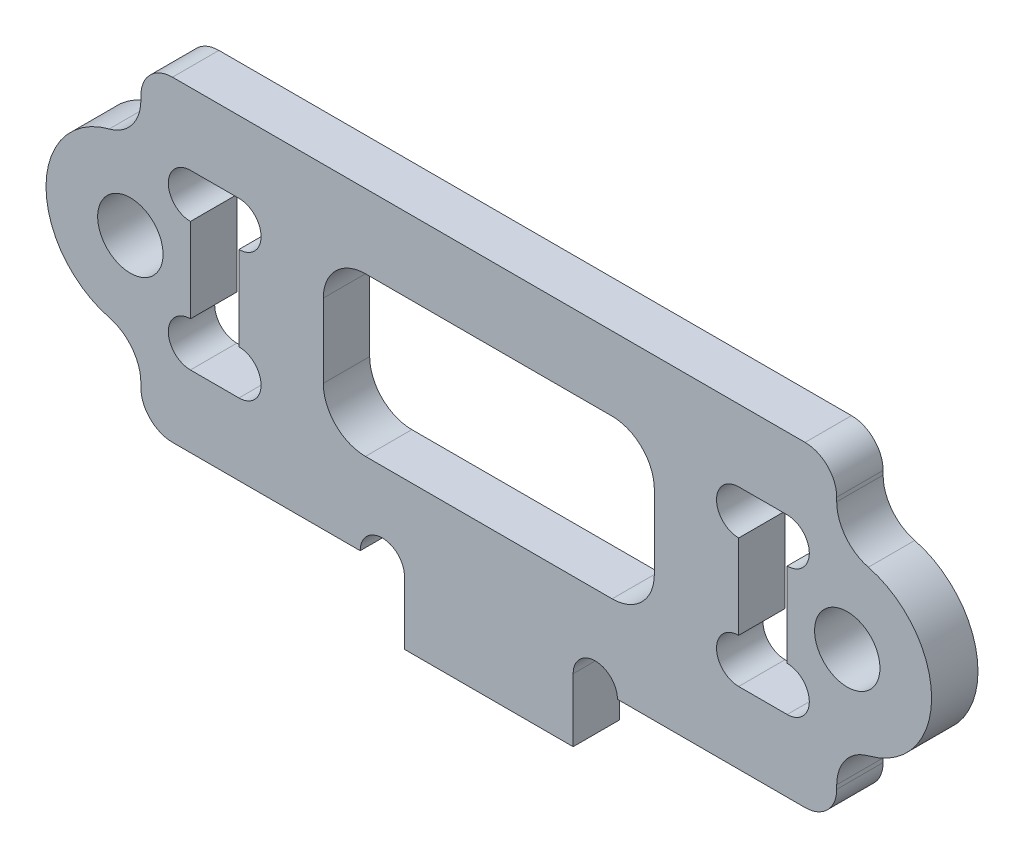
from build123d import *

# Parameters (mm, degrees)
SKETCH_1_R      = 1.55
SKETCH_1_W      = 15.7
SKETCH_1_H      = 7.5
EXTRUDE_1_DEPTH = 2.2
FILLET_1_R      = 2
FILLET_2_R      = 1.5
FILLET_3_R      = 2


with BuildPart() as part:
    # 草图1 → 凸台-拉伸1 (new body)
    with BuildSketch(Plane.XY):
        with BuildLine():
            ThreePointArc((-16.5, 3.968626967), (-21, 0), (-16.5, -3.968626967))
            Line((-16.5, -3.968626967), (-16.5, -7.5))
            Line((-16.5, -7.5), (-6.1, -7.5))
            ThreePointArc((-6.1, -7.5), (-5.05, -6.45), (-4, -7.5))
            Line((-4, -7.5), (-4, -10.5))
            Line((-4, -10.5), (4, -10.5))
            Line((4, -10.5), (4, -7.5))
            ThreePointArc((4, -7.5), (5.05, -6.45), (6.1, -7.5))
            Line((6.1, -7.5), (16.5, -7.5))
            Line((16.5, -7.5), (16.5, -3.968626967))
            ThreePointArc((16.5, -3.968626967), (21, 0), (16.5, 3.968626967))
            Line((16.5, 3.968626967), (16.5, 7.5))
            Line((16.5, 7.5), (-16.5, 7.5))
            Line((-16.5, 7.5), (-16.5, 3.968626967))
        make_face()
        with Locations((-17, 0)):
            Circle(SKETCH_1_R, mode=Mode.SUBTRACT)
        with BuildLine():
            Line((-14.15, 4.1), (-11.85, 4.1))
            ThreePointArc((-11.85, 4.1), (-11.10753788, 3.79246212), (-10.8, 3.05))
            ThreePointArc((-10.8, 3.05), (-11.10753788, 2.30753788), (-11.85, 2))
            Line((-11.85, 2), (-11.85, -2))
            ThreePointArc((-11.85, -2), (-11.10753788, -2.30753788), (-10.8, -3.05))
            ThreePointArc((-10.8, -3.05), (-11.10753788, -3.79246212), (-11.85, -4.1))
            Line((-11.85, -4.1), (-14.15, -4.1))
            ThreePointArc((-14.15, -4.1), (-15.2, -3.05), (-14.15, -2))
            Line((-14.15, -2), (-14.15, 2))
            ThreePointArc((-14.15, 2), (-15.2, 3.05), (-14.15, 4.1))
        make_face(mode=Mode.SUBTRACT)
        with Locations((0, 0.25)):
            Rectangle(SKETCH_1_W, SKETCH_1_H, mode=Mode.SUBTRACT)
        with BuildLine():
            Line((11.85, 4.1), (14.15, 4.1))
            ThreePointArc((14.15, 4.1), (14.89246212, 3.79246212), (15.2, 3.05))
            ThreePointArc((15.2, 3.05), (14.89246212, 2.30753788), (14.15, 2))
            Line((14.15, 2), (14.15, -2))
            ThreePointArc((14.15, -2), (14.89246212, -2.30753788), (15.2, -3.05))
            ThreePointArc((15.2, -3.05), (14.89246212, -3.79246212), (14.15, -4.1))
            Line((14.15, -4.1), (11.85, -4.1))
            ThreePointArc((11.85, -4.1), (10.8, -3.05), (11.85, -2))
            Line((11.85, -2), (11.85, 2))
            ThreePointArc((11.85, 2), (10.8, 3.05), (11.85, 4.1))
        make_face(mode=Mode.SUBTRACT)
        with Locations((17, 0)):
            Circle(SKETCH_1_R, mode=Mode.SUBTRACT)
    extrude(amount=EXTRUDE_1_DEPTH)

    # 圆角1
    fillet_1_edges = [part.edges().sort_by_distance(p)[0] for p in [
        (-16.5, -3.968626967, 1.1),
        (-16.5, 3.968626967, 1.1),
        (16.5, 3.968626967, 1.1),
        (16.5, -3.968626967, 1.1),
    ]]
    fillet(fillet_1_edges, radius=FILLET_1_R)

    # 圆角2
    fillet_2_edges = [part.edges().sort_by_distance(p)[0] for p in [
        (-16.5, -7.5, 1.1),
        (-16.5, 7.5, 1.1),
        (16.5, 7.5, 1.1),
        (16.5, -7.5, 1.1),
    ]]
    fillet(fillet_2_edges, radius=FILLET_2_R)

    # 圆角3
    fillet_3_edges = [part.edges().sort_by_distance(p)[0] for p in [
        (-7.85, -3.5, 1.1),
        (7.85, -3.5, 1.1),
        (7.85, 4, 1.1),
        (-7.85, 4, 1.1),
    ]]
    fillet(fillet_3_edges, radius=FILLET_3_R)


solid = part.part
